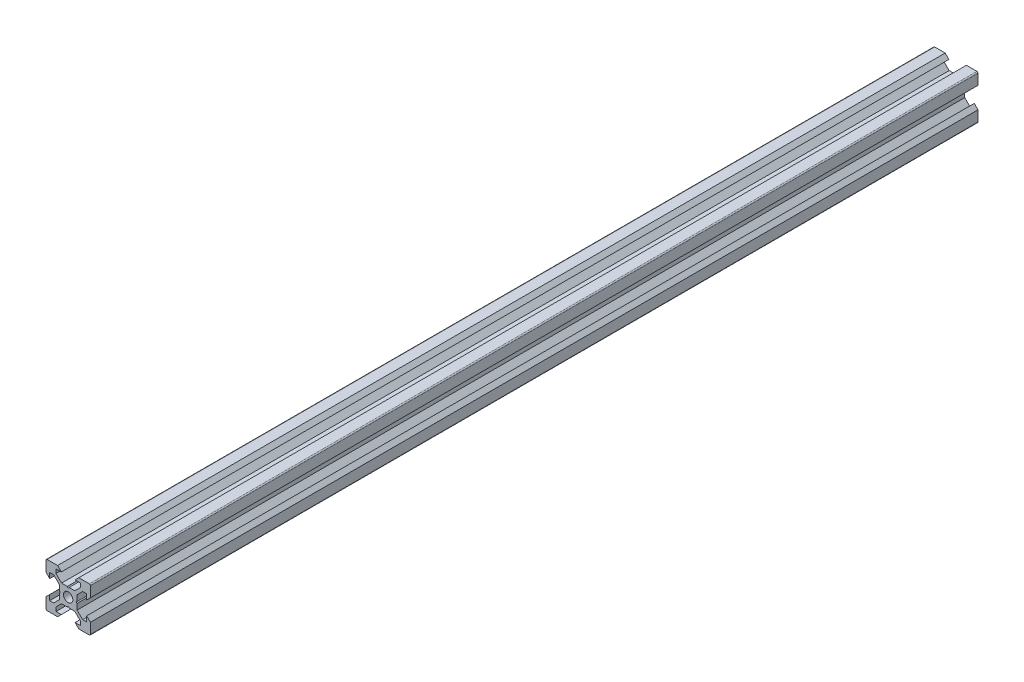
from build123d import *

# Parameters (mm, degrees)
SKETCH1_R           = 2.1
BOSS_EXTRUDE1_DEPTH = 400
FILLET1_R           = 0.5
CUT_EXTRUDE1_DEPTH  = 401.249921924


with BuildPart() as part:
    # Sketch1 → Boss-Extrude1 (new body)
    with BuildSketch(Plane.XY):
        Polygon((-10, 10), (-4.775, 10), (-3.1, 8.325), (-5.5, 8.325), (-5.5, 6.525), (-3, 4.025), (3, 4.025), (5.5, 6.525), (5.5, 8.325), (3.1, 8.325), (4.775, 10), (10, 10), (10, 4.775), (8.325, 3.1), (8.325, 5.5), (6.525, 5.5), (4.025, 3), (4.025, -3), (6.525, -5.5), (8.325, -5.5), (8.325, -3.1), (10, -4.775), (10, -10), (4.775, -10), (3.1, -8.325), (5.5, -8.325), (5.5, -6.525), (3, -4.025), (-3, -4.025), (-5.5, -6.525), (-5.5, -8.325), (-3.1, -8.325), (-4.775, -10), (-10, -10), (-10, -4.775), (-8.325, -3.1), (-8.325, -5.5), (-6.525, -5.5), (-4.025, -3), (-4.025, 3), (-6.525, 5.5), (-8.325, 5.5), (-8.325, 3.1), (-10, 4.775), align=None)
        Circle(SKETCH1_R, mode=Mode.SUBTRACT)
    extrude(amount=BOSS_EXTRUDE1_DEPTH)

    # Fillet1
    fillet1_edges = [part.edges().sort_by_distance(p)[0] for p in [
        (10, -10, 200),
        (-10, -10, 200),
        (-10, 10, 200),
        (10, 10, 200),
    ]]
    fillet(fillet1_edges, radius=FILLET1_R)

    # Sketch2 → Cut-Extrude1 (cut, through all)
    with BuildSketch(Plane.XY.offset(400)):
        with BuildLine():
            ThreePointArc((-4.025, 0.4), (-4.425, 0), (-4.025, -0.4))
            Line((-4.025, -0.4), (-4.025, 0.4))
        make_face()
        with BuildLine():
            Line((-4.025, 0.4), (-4.025, -0.4))
            ThreePointArc((-4.025, -0.4), (-3.742157288, -0.282842712), (-3.625, 0))
            ThreePointArc((-3.625, 0), (-3.742157288, 0.282842712), (-4.025, 0.4))
        make_face()
        with BuildLine():
            ThreePointArc((0.4, 4.025), (0, 4.425), (-0.4, 4.025))
            Line((-0.4, 4.025), (0.4, 4.025))
        make_face()
        with BuildLine():
            Line((0.4, 4.025), (-0.4, 4.025))
            ThreePointArc((-0.4, 4.025), (0, 3.625), (0.4, 4.025))
        make_face()
        with BuildLine():
            ThreePointArc((4.025, 0.4), (3.625, 0), (4.025, -0.4))
            Line((4.025, -0.4), (4.025, 0.4))
        make_face()
        with BuildLine():
            Line((4.025, 0.4), (4.025, -0.4))
            ThreePointArc((4.025, -0.4), (4.307842712, -0.282842712), (4.425, 0))
            ThreePointArc((4.425, 0), (4.307842712, 0.282842712), (4.025, 0.4))
        make_face()
        with BuildLine():
            ThreePointArc((0.4, -4.025), (0, -3.625), (-0.4, -4.025))
            Line((-0.4, -4.025), (0.4, -4.025))
        make_face()
        with BuildLine():
            Line((0.4, -4.025), (-0.4, -4.025))
            ThreePointArc((-0.4, -4.025), (0, -4.425), (0.4, -4.025))
        make_face()
    extrude(amount=-CUT_EXTRUDE1_DEPTH, mode=Mode.SUBTRACT)


solid = part.part
